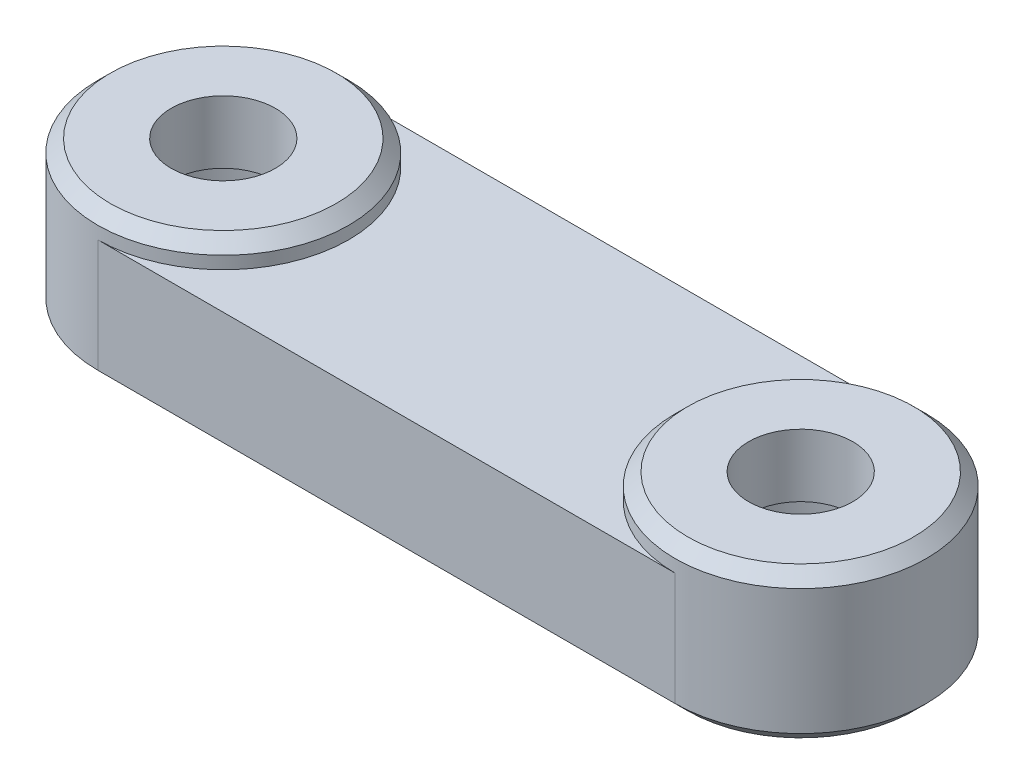
from build123d import *

# Parameters (mm, degrees)
EXTRUDE_1_DEPTH     = 6
CUT_EXTRUDE_START   = -1
SKETCH_4_W          = 37.365757144
SKETCH_4_H          = 18.186872946
SKETCH_4_R          = 5
CUT_EXTRUDE_1_DEPTH = 1
CHAMFER_1_SIZE      = 0.5


with BuildPart() as part:
    # 草图1 → 凸台-拉伸1 (new body)
    with BuildSketch(Plane(origin=(0, 0, 0), x_dir=(1, 0, 0), z_dir=(0, 1, 0))):
        with BuildLine():
            Line((0, 5), (23, 5))
            ThreePointArc((23, 5), (28, 0), (23, -5))
            Line((23, -5), (0, -5))
            ThreePointArc((0, -5), (-5, 0), (0, 5))
        make_face()
    extrude(amount=EXTRUDE_1_DEPTH)

    # 草图2 → 切除-旋转1 (revolve, cut)
    with BuildSketch(Plane.XY, mode=Mode.PRIVATE) as cut_revolve_1_sk:
        Polygon((0, 0), (-3.75, 0), (-3.75, 3.5), (-2.075, 3.5), (-2.075, 6), (0, 6), align=None)
    revolve(cut_revolve_1_sk.sketch.rotate(Axis((0, 6, 0), (0, -1, 0)), 270), axis=Axis((0, 6, 0), (0, -1, 0)), mode=Mode.SUBTRACT)

    # 草图3 → 切除-旋转2 (revolve, cut)
    with BuildSketch(Plane.XY, mode=Mode.PRIVATE) as cut_revolve_2_sk:
        Polygon((23, 0), (19.25, 0), (19.25, 3.5), (20.925, 3.5), (20.925, 6), (23, 6), align=None)
    revolve(cut_revolve_2_sk.sketch.rotate(Axis((23, 0, 0), (0, 1, 0)), 270), axis=Axis((23, 0, 0), (0, 1, 0)), mode=Mode.SUBTRACT)

    # 草图4 → 切除-拉伸1 (cut)
    with BuildSketch(Plane(origin=(0, 6, 0), x_dir=(1, 0, 0), z_dir=(0, 1, 0)).offset(CUT_EXTRUDE_START)):
        with Locations((11.904152732, 0.202076366)):
            Rectangle(SKETCH_4_W, SKETCH_4_H)
        with Locations(Location((0, 0, 0), (0, 0, 270))):
            Circle(SKETCH_4_R, mode=Mode.SUBTRACT)
        with Locations(Location((23, 0, 0), (0, 0, 270))):
            Circle(SKETCH_4_R, mode=Mode.SUBTRACT)
    extrude(amount=CUT_EXTRUDE_1_DEPTH, mode=Mode.SUBTRACT)

    # 倒角1
    chamfer_1_edges = [part.edges().sort_by_distance(p)[0] for p in [
        (23, 6, 5),
        (0, 6, -5),
        (11.5, 0, -5),
        (28, 0, 0),
        (11.5, 0, 5),
        (-5, 0, 0),
    ]]
    chamfer(chamfer_1_edges, length=CHAMFER_1_SIZE)


solid = part.part
